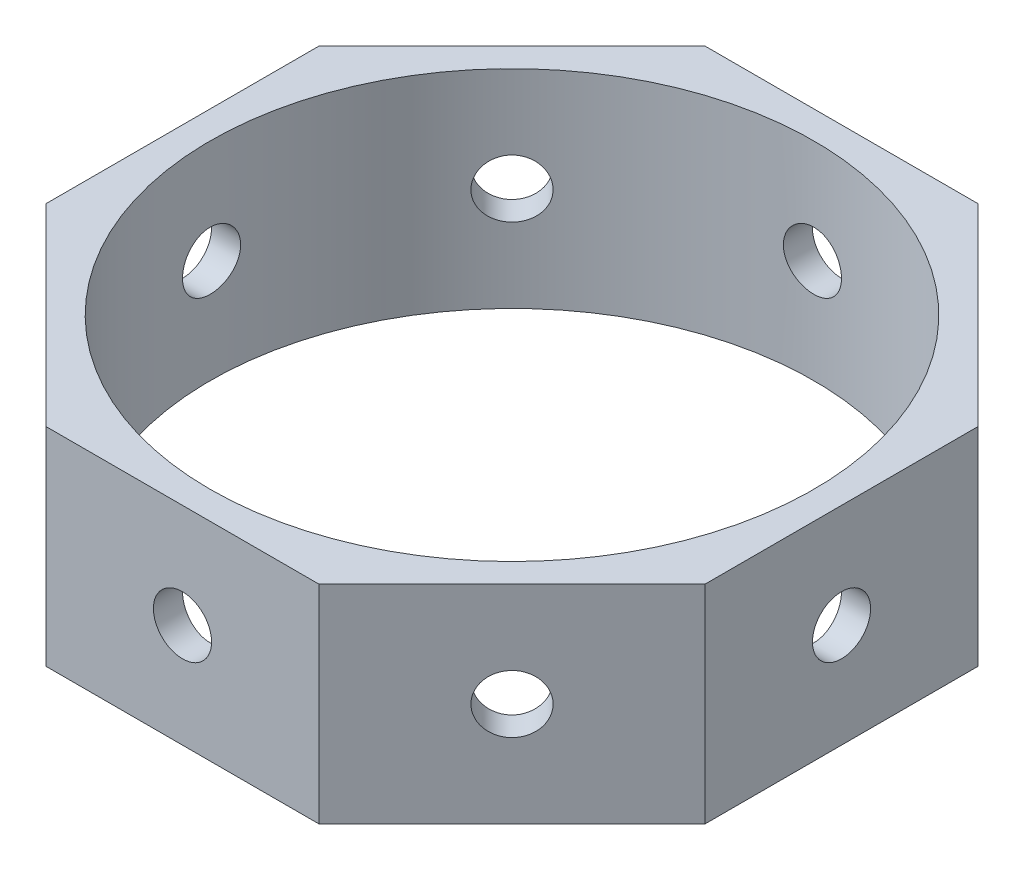
from build123d import *

# Parameters (mm, degrees)
SKETCH1_R               = 27.686
BOSS_EXTRUDE1_DEPTH     = 19.05
CUT_EXTRUDE1_REACH      = 72.221
CUT_EXTRUDE1_END_RADIUS = 27.686
SKETCH2_R               = 2.667
CIRPATTERN1_COUNT       = 8


with BuildPart() as part:
    # Sketch1 → Boss-Extrude1 (new body)
    with BuildSketch(Plane(origin=(0, 0, 0), x_dir=(1, 0, 0), z_dir=(0, 1, 0))):
        Polygon((12.520019136, 30.226), (-12.520019136, 30.226), (-30.226, 12.520019136), (-30.226, -12.520019136), (-12.520019136, -30.226), (12.520019136, -30.226), (30.226, -12.520019136), (30.226, 12.520019136), align=None)
        with Locations(Location((0, 0, 0), (0, 0, 90))):
            Circle(SKETCH1_R, mode=Mode.SUBTRACT)
    extrude(amount=BOSS_EXTRUDE1_DEPTH)

    # Cut-Extrude1: up to this cylinder (the profile starts outside it)
    cut_extrude1_end = Plane(origin=(0, 9.525, 0), z_dir=(0, -1, 0)) * Cylinder(CUT_EXTRUDE1_END_RADIUS, 200.814, mode=Mode.PRIVATE)
    # Sketch2 → Cut-Extrude1 (cut, up to the surface)
    with BuildSketch(Plane.XY.offset(30.226), mode=Mode.PRIVATE) as cut_extrude1_sk1:
        with Locations((0, 9.525)):
            Circle(SKETCH2_R)
    cut_extrude1_tool1 = extrude(cut_extrude1_sk1.sketch, amount=-CUT_EXTRUDE1_REACH, mode=Mode.PRIVATE) - cut_extrude1_end
    cut_extrude1 = cut_extrude1_tool1.solids().sort_by_distance((0, 9.525, 30.226))[0]
    add(cut_extrude1, mode=Mode.SUBTRACT)

    # CirPattern1: Cut-Extrude1 ×8 about axis
    cirpattern1_axis = Axis((0, 19.05, 0), (0, 1, 0))
    for i in range(1, CIRPATTERN1_COUNT):
        add(cut_extrude1.rotate(cirpattern1_axis, i * 360 / CIRPATTERN1_COUNT), mode=Mode.SUBTRACT)


solid = part.part
